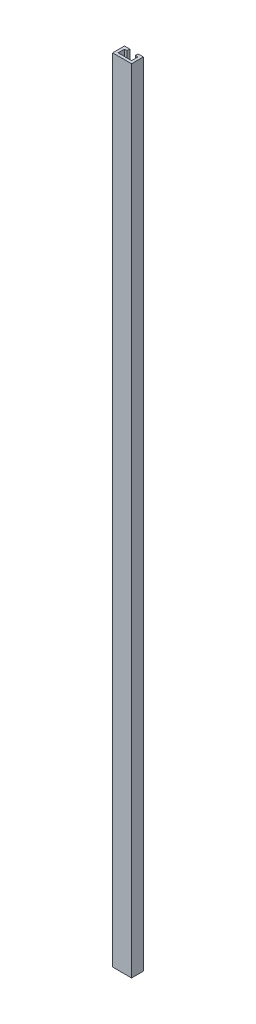
from build123d import *

# Parameters (mm, degrees)
EXTRUDE_1_DEPTH = 335


with BuildPart() as part:
    # 草图1 → 凸台-拉伸1 (new body)
    with BuildSketch(Plane(origin=(0, 0, 0), x_dir=(1, 0, 0), z_dir=(0, 1, 0))):
        Polygon((0, -5), (8, -5), (8, 0), (5.75, 0), (5.75, -1.15), (6.85, -1.15), (6.85, -3.85), (1.15, -3.85), (1.15, -1.15), (2.25, -1.15), (2.25, 0), (0, 0), align=None)
    extrude(amount=EXTRUDE_1_DEPTH)


solid = part.part
